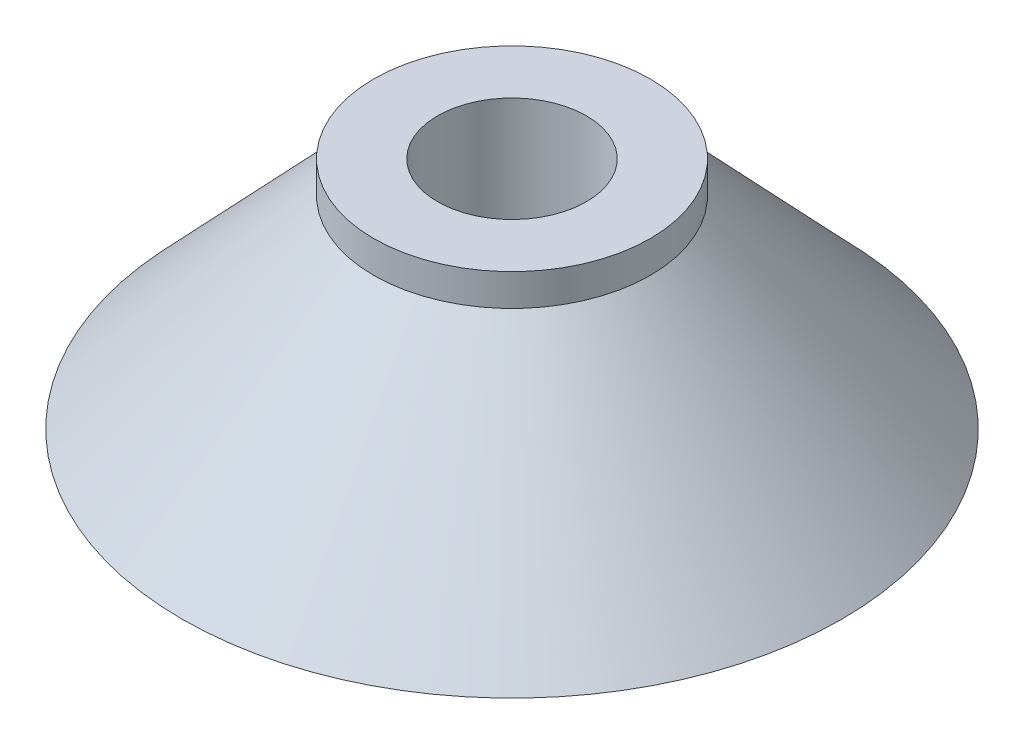
from build123d import *

# Parameters (mm, degrees)
SKETCH_1_W = 1.5
SKETCH_1_H = 5.5


with BuildPart() as part:
    # Эскиз1 → Повернуть1 (revolve)
    with BuildSketch(Plane.XY, mode=Mode.PRIVATE) as revolve_1_sk:
        with Locations((2.5, 2.75)):
            Rectangle(SKETCH_1_W, SKETCH_1_H)
        Polygon((7.75, 0), (3.25, 4.75), (3.25, 0), align=None)
    revolve(revolve_1_sk.sketch.rotate(Axis((0, 0, 0), (0, 1, 0)), 90), axis=Axis((0, 0, 0), (0, 1, 0)))


solid = part.part
